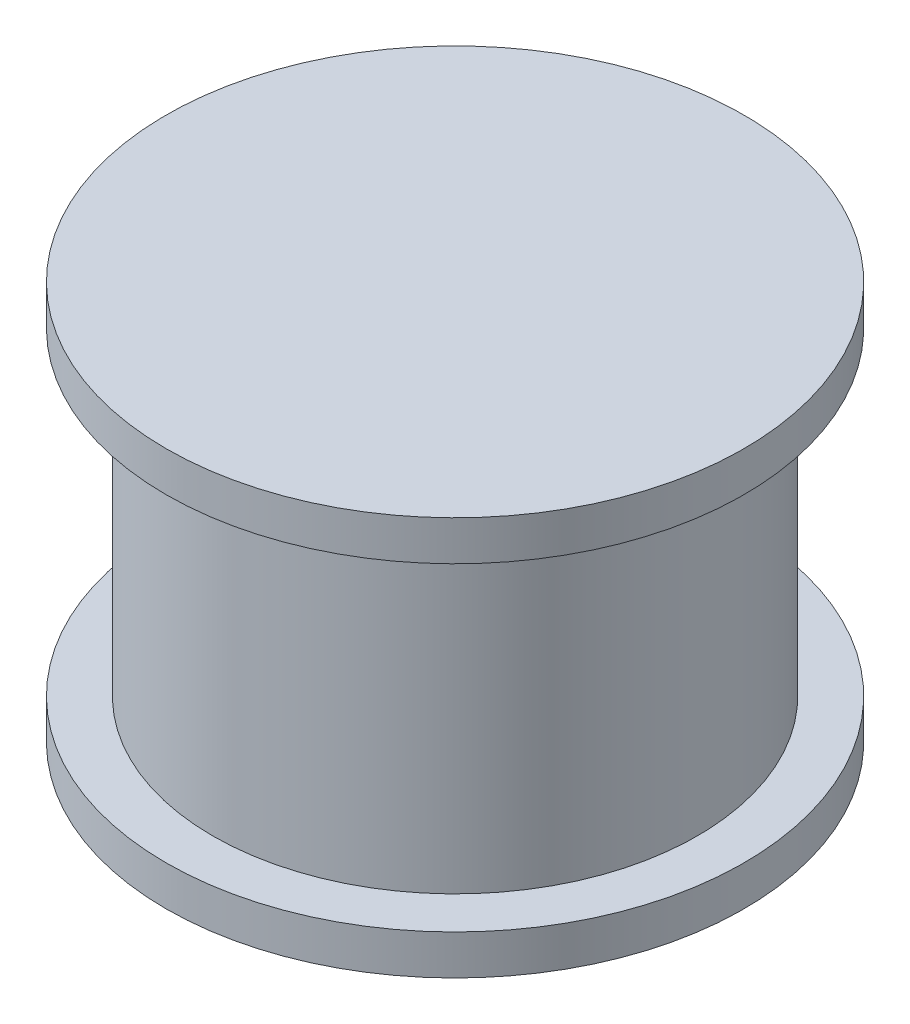
from build123d import *

# Parameters (mm, degrees)
SKETCH1_R           = 14.5
BOSS_EXTRUDE1_DEPTH = 2
SKETCH2_R           = 12.16
BOSS_EXTRUDE2_DEPTH = 16
SKETCH3_R           = 14.5
BOSS_EXTRUDE3_DEPTH = 2


with BuildPart() as part:
    # Sketch1 → Boss-Extrude1 (new body)
    with BuildSketch(Plane(origin=(0, 0, 0), x_dir=(1, 0, 0), z_dir=(0, 1, 0))):
        with Locations(Location((0, 0, 0), (0, 0, 270))):
            Circle(SKETCH1_R)
    extrude(amount=BOSS_EXTRUDE1_DEPTH)

    # Sketch2 → Boss-Extrude2 (add)
    with BuildSketch(Plane(origin=(0, 2, 0), x_dir=(1, 0, 0), z_dir=(0, 1, 0))):
        with Locations(Location((0, 0, 0), (0, 0, 270))):
            Circle(SKETCH2_R)
    extrude(amount=BOSS_EXTRUDE2_DEPTH)

    # Sketch3 → Boss-Extrude3 (add)
    with BuildSketch(Plane(origin=(0, 18, 0), x_dir=(1, 0, 0), z_dir=(0, 1, 0))):
        with Locations(Location((0, 0, 0), (0, 0, 270))):
            Circle(SKETCH3_R)
    extrude(amount=BOSS_EXTRUDE3_DEPTH)


solid = part.part
